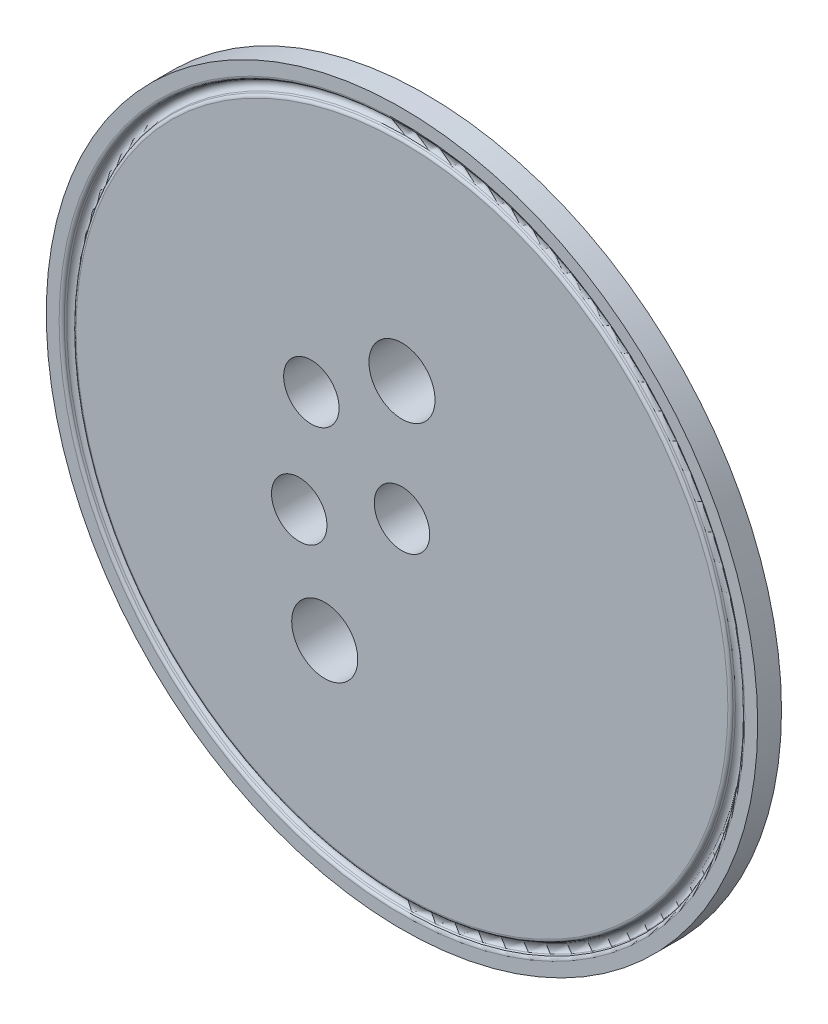
from build123d import *

# Parameters (mm, degrees)
SKETCH2_R          = 6.5
SKETCH2_R_2        = 7.75
CUT_EXTRUDE1_DEPTH = 119.521470637


with BuildPart() as part:
    # Sketch1 → Revolve1 (revolve)
    with BuildSketch(Plane(origin=(0, 0, 0), x_dir=(0, 0, -1), z_dir=(1, 0, 0)), mode=Mode.PRIVATE) as revolve1_sk:
        with BuildLine():
            Line((0, 0), (0, 76.444627725))
            ThreePointArc((0, 76.444627725), (0.130798304, 76.879222907), (0.479738309, 77.169433247))
            Line((0.479738309, 77.169433247), (0.872854821, 77.336301306))
            ThreePointArc((0.872854821, 77.336301306), (1.6002, 78.4352), (0.872854821, 79.534098694))
            Line((0.872854821, 79.534098694), (0.479738309, 79.700966753))
            ThreePointArc((0.479738309, 79.700966753), (0.130798304, 79.991177093), (0, 80.425772275))
            Line((0, 80.425772275), (0, 83.439))
            Line((0, 83.439), (5.588, 83.439))
            Line((5.588, 83.439), (11.0998, 68.295453959))
            Line((11.0998, 68.295453959), (11.0998, 0))
            Line((11.0998, 0), (0, 0))
        make_face()
    revolve(revolve1_sk.sketch.rotate(Axis((0, 0, 0), (0, 0, -1)), 90), axis=Axis((0, 0, 0), (0, 0, -1)))

    # Sketch2 → Cut-Extrude1 (cut, through all)
    with BuildSketch(Plane(origin=(0, 0, -11.0998), x_dir=(-1, 0, 0), z_dir=(0, 0, -1))):
        Circle(SKETCH2_R)
        with Locations((0, 27.9765569)):
            Circle(SKETCH2_R_2)
        with Locations((24.098999837, -10.15759269)):
            Circle(SKETCH2_R)
        with Locations((21.259374059, 15.100131331)):
            Circle(SKETCH2_R)
        with Locations((18.120840305, -33.771322839)):
            Circle(SKETCH2_R_2)
    extrude(amount=-CUT_EXTRUDE1_DEPTH, mode=Mode.SUBTRACT)


solid = part.part
